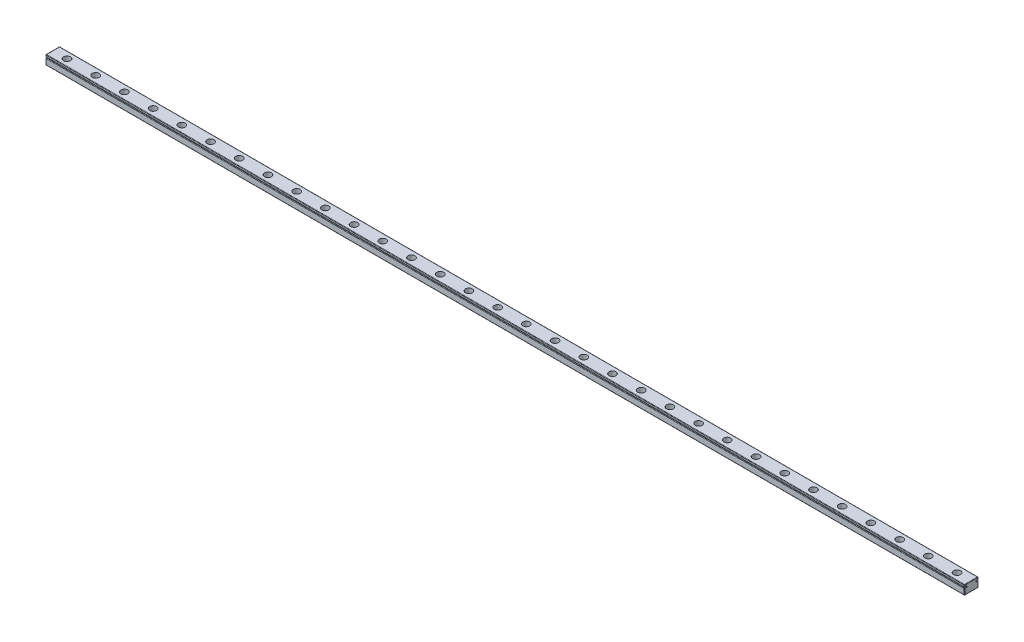
from build123d import *

# Parameters (mm, degrees)
SKETCH1_W           = 12
SKETCH1_H           = 8
BOSS_EXTRUDE1_DEPTH = 800
SKETCH2_R           = 3
CUT_EXTRUDE1_DEPTH  = 4.5
SKETCH3_R           = 1.75
CUT_EXTRUDE2_DEPTH  = 3.5
CUT_EXTRUDE3_REACH  = 802.032
SKETCH4_W           = 1.75
SKETCH4_H           = 0.5
FILLET2_R           = 0.4


with BuildPart() as part:
    # Sketch1 → Boss-Extrude1 (new body)
    with BuildSketch(Plane(origin=(0, 0, 0), x_dir=(0, 0, -1), z_dir=(1, 0, 0))):
        Rectangle(SKETCH1_W, SKETCH1_H)
    extrude(amount=BOSS_EXTRUDE1_DEPTH)

    # Sketch2 → Cut-Extrude1 (cut)
    with BuildSketch(Plane(origin=(0, 4, 0), x_dir=(1, 0, 0), z_dir=(0, 1, 0))):
        with Locations(Location((412.5, 0, 0), (0, 0, 270))):
            Circle(SKETCH2_R)
        with Locations(Location((437.5, 0, 0), (0, 0, 270))):
            Circle(SKETCH2_R)
        with Locations(Location((462.5, 0, 0), (0, 0, 270))):
            Circle(SKETCH2_R)
        with Locations(Location((487.5, 0, 0), (0, 0, 270))):
            Circle(SKETCH2_R)
        with Locations(Location((512.5, 0, 0), (0, 0, 270))):
            Circle(SKETCH2_R)
        with Locations(Location((537.5, 0, 0), (0, 0, 270))):
            Circle(SKETCH2_R)
        with Locations(Location((562.5, 0, 0), (0, 0, 270))):
            Circle(SKETCH2_R)
        with Locations(Location((587.5, 0, 0), (0, 0, 270))):
            Circle(SKETCH2_R)
        with Locations(Location((612.5, 0, 0), (0, 0, 270))):
            Circle(SKETCH2_R)
        with Locations(Location((637.5, 0, 0), (0, 0, 270))):
            Circle(SKETCH2_R)
        with Locations(Location((662.5, 0, 0), (0, 0, 270))):
            Circle(SKETCH2_R)
        with Locations(Location((687.5, 0, 0), (0, 0, 270))):
            Circle(SKETCH2_R)
        with Locations(Location((712.5, 0, 0), (0, 0, 270))):
            Circle(SKETCH2_R)
        with Locations(Location((737.5, 0, 0), (0, 0, 270))):
            Circle(SKETCH2_R)
        with Locations(Location((762.5, 0, 0), (0, 0, 270))):
            Circle(SKETCH2_R)
        with Locations(Location((787.5, 0, 0), (0, 0, 270))):
            Circle(SKETCH2_R)
        with Locations(Location((387.5, 0, 0), (0, 0, 270))):
            Circle(SKETCH2_R)
        with Locations(Location((362.5, 0, 0), (0, 0, 270))):
            Circle(SKETCH2_R)
        with Locations(Location((337.5, 0, 0), (0, 0, 270))):
            Circle(SKETCH2_R)
        with Locations(Location((312.5, 0, 0), (0, 0, 270))):
            Circle(SKETCH2_R)
        with Locations(Location((287.5, 0, 0), (0, 0, 270))):
            Circle(SKETCH2_R)
        with Locations(Location((262.5, 0, 0), (0, 0, 270))):
            Circle(SKETCH2_R)
        with Locations(Location((237.5, 0, 0), (0, 0, 270))):
            Circle(SKETCH2_R)
        with Locations(Location((212.5, 0, 0), (0, 0, 270))):
            Circle(SKETCH2_R)
        with Locations(Location((187.5, 0, 0), (0, 0, 270))):
            Circle(SKETCH2_R)
        with Locations(Location((162.5, 0, 0), (0, 0, 270))):
            Circle(SKETCH2_R)
        with Locations(Location((137.5, 0, 0), (0, 0, 270))):
            Circle(SKETCH2_R)
        with Locations(Location((112.5, 0, 0), (0, 0, 270))):
            Circle(SKETCH2_R)
        with Locations(Location((87.5, 0, 0), (0, 0, 270))):
            Circle(SKETCH2_R)
        with Locations(Location((62.5, 0, 0), (0, 0, 270))):
            Circle(SKETCH2_R)
        with Locations(Location((37.5, 0, 0), (0, 0, 270))):
            Circle(SKETCH2_R)
        with Locations(Location((12.5, 0, 0), (0, 0, 270))):
            Circle(SKETCH2_R)
    extrude(amount=-CUT_EXTRUDE1_DEPTH, mode=Mode.SUBTRACT)

    # Sketch3 → Cut-Extrude2 (cut)
    with BuildSketch(Plane(origin=(0, -0.5, 0), x_dir=(1, 0, 0), z_dir=(0, 1, 0))):
        with Locations(Location((12.5, 0, 0), (0, 0, 270))):
            Circle(SKETCH3_R)
        with Locations(Location((37.5, 0, 0), (0, 0, 270))):
            Circle(SKETCH3_R)
        with Locations(Location((62.5, 0, 0), (0, 0, 270))):
            Circle(SKETCH3_R)
        with Locations(Location((87.5, 0, 0), (0, 0, 270))):
            Circle(SKETCH3_R)
        with Locations(Location((112.5, 0, 0), (0, 0, 270))):
            Circle(SKETCH3_R)
        with Locations(Location((137.5, 0, 0), (0, 0, 270))):
            Circle(SKETCH3_R)
        with Locations(Location((162.5, 0, 0), (0, 0, 270))):
            Circle(SKETCH3_R)
        with Locations(Location((187.5, 0, 0), (0, 0, 270))):
            Circle(SKETCH3_R)
        with Locations(Location((212.5, 0, 0), (0, 0, 270))):
            Circle(SKETCH3_R)
        with Locations(Location((237.5, 0, 0), (0, 0, 270))):
            Circle(SKETCH3_R)
        with Locations(Location((262.5, 0, 0), (0, 0, 270))):
            Circle(SKETCH3_R)
        with Locations(Location((287.5, 0, 0), (0, 0, 270))):
            Circle(SKETCH3_R)
        with Locations(Location((312.5, 0, 0), (0, 0, 270))):
            Circle(SKETCH3_R)
        with Locations(Location((337.5, 0, 0), (0, 0, 270))):
            Circle(SKETCH3_R)
        with Locations(Location((362.5, 0, 0), (0, 0, 270))):
            Circle(SKETCH3_R)
        with Locations(Location((387.5, 0, 0), (0, 0, 270))):
            Circle(SKETCH3_R)
        with Locations(Location((412.5, 0, 0), (0, 0, 270))):
            Circle(SKETCH3_R)
        with Locations(Location((437.5, 0, 0), (0, 0, 270))):
            Circle(SKETCH3_R)
        with Locations(Location((462.5, 0, 0), (0, 0, 270))):
            Circle(SKETCH3_R)
        with Locations(Location((487.5, 0, 0), (0, 0, 270))):
            Circle(SKETCH3_R)
        with Locations(Location((512.5, 0, 0), (0, 0, 270))):
            Circle(SKETCH3_R)
        with Locations(Location((537.5, 0, 0), (0, 0, 270))):
            Circle(SKETCH3_R)
        with Locations(Location((562.5, 0, 0), (0, 0, 270))):
            Circle(SKETCH3_R)
        with Locations(Location((587.5, 0, 0), (0, 0, 270))):
            Circle(SKETCH3_R)
        with Locations(Location((612.5, 0, 0), (0, 0, 270))):
            Circle(SKETCH3_R)
        with Locations(Location((637.5, 0, 0), (0, 0, 270))):
            Circle(SKETCH3_R)
        with Locations(Location((662.5, 0, 0), (0, 0, 270))):
            Circle(SKETCH3_R)
        with Locations(Location((687.5, 0, 0), (0, 0, 270))):
            Circle(SKETCH3_R)
        with Locations(Location((712.5, 0, 0), (0, 0, 270))):
            Circle(SKETCH3_R)
        with Locations(Location((737.5, 0, 0), (0, 0, 270))):
            Circle(SKETCH3_R)
        with Locations(Location((762.5, 0, 0), (0, 0, 270))):
            Circle(SKETCH3_R)
        with Locations(Location((787.5, 0, 0), (0, 0, 270))):
            Circle(SKETCH3_R)
    extrude(amount=-CUT_EXTRUDE2_DEPTH, mode=Mode.SUBTRACT)

    # Sketch4 → Cut-Extrude3 (cut, up to next)
    with BuildSketch(Plane.ZY, mode=Mode.PRIVATE) as cut_extrude3_sk1:
        with Locations((-5.125, 1.75)):
            Rectangle(SKETCH4_W, SKETCH4_H)
    cut_extrude3_tool1 = extrude(cut_extrude3_sk1.sketch, amount=-CUT_EXTRUDE3_REACH, mode=Mode.PRIVATE) & part.part
    # Sketch4 → Cut-Extrude3 (cut, up to next)
    with BuildSketch(Plane.ZY, mode=Mode.PRIVATE) as cut_extrude3_sk2:
        with Locations((5.125, 1.75)):
            Rectangle(SKETCH4_W, SKETCH4_H)
    cut_extrude3_tool2 = extrude(cut_extrude3_sk2.sketch, amount=-CUT_EXTRUDE3_REACH, mode=Mode.PRIVATE) & part.part
    add(cut_extrude3_tool1.solids().sort_by_distance((0, 1.75, -5.125))[0], mode=Mode.SUBTRACT)
    add(cut_extrude3_tool2.solids().sort_by_distance((0, 1.75, 5.125))[0], mode=Mode.SUBTRACT)

    # Fillet2
    fillet2_edges = [part.edges().sort_by_distance(p)[0] for p in [
        (800, -1.25, -6),
        (800, 4, 0),
        (0, 3, -6),
        (800, 3, -6),
        (400, 1.5, -6),
        (800, 2, -5.125),
        (400, 2, -6),
        (800, 1.75, -4.25),
        (800, 1.5, -5.125),
        (0, 1.5, -5.125),
        (0, 1.75, -4.25),
        (0, 2, -5.125),
        (0, -1.25, 6),
        (800, -1.25, 6),
        (800, 1.5, 5.125),
        (400, 1.5, 6),
        (800, 1.75, 4.25),
        (800, 2, 5.125),
        (400, 2, 6),
        (0, 1.5, 5.125),
        (0, 2, 5.125),
        (0, 1.75, 4.25),
        (800, 3, 6),
        (0, 4, 0),
        (0, -1.25, -6),
        (0, -4, 0),
        (0, 3, 6),
        (800, -4, 0),
        (400, 4, 6),
        (400, 4, -6),
        (400, -4, -6),
        (400, -4, 6),
    ]]
    fillet(fillet2_edges, radius=FILLET2_R)


solid = part.part
